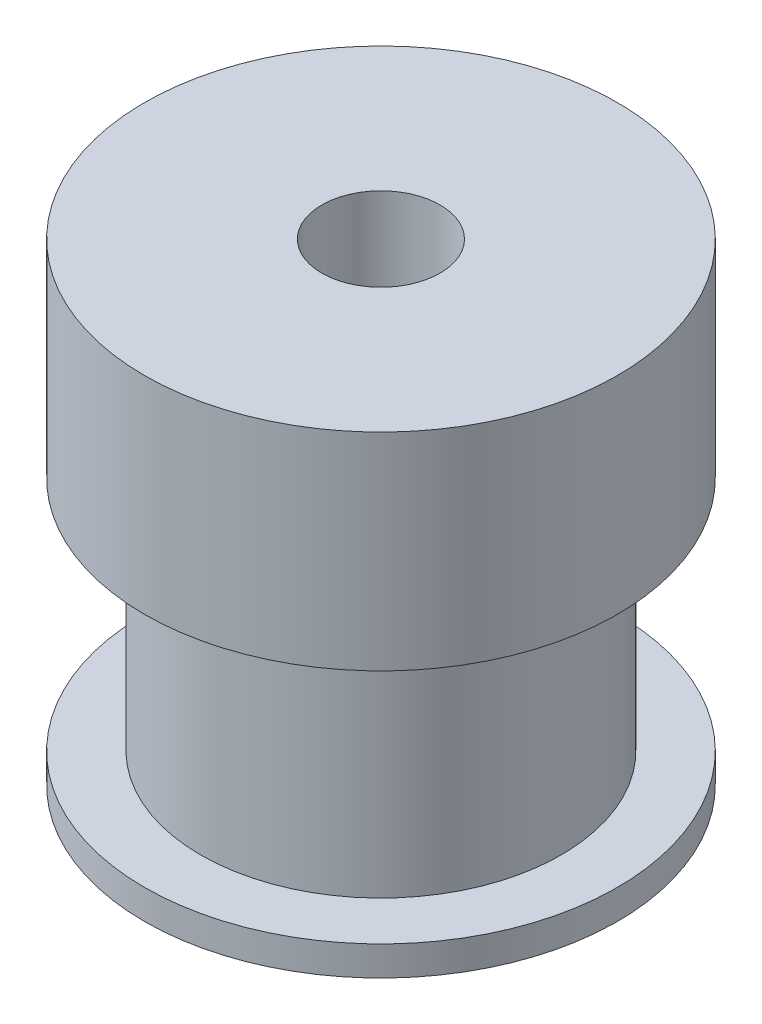
from build123d import *

# Parameters (mm, degrees)
ESQUISSE1_R      = 8
EXTRUSION1_DEPTH = 1
ESQUISSE2_R      = 6.1
EXTRUSION2_DEPTH = 8
ESQUISSE3_R      = 8
EXTRUSION3_DEPTH = 7
ESQUISSE4_R      = 2
EXTRUSION4_DEPTH = 20.595917942


with BuildPart() as part:
    # Esquisse1 → Extrusion1 (new body)
    with BuildSketch(Plane(origin=(0, 0, 0), x_dir=(1, 0, 0), z_dir=(0, 1, 0))):
        with Locations(Location((0, 0, 0), (0, 0, 270))):
            Circle(ESQUISSE1_R)
    extrude(amount=EXTRUSION1_DEPTH)

    # Esquisse2 → Extrusion2 (add)
    with BuildSketch(Plane(origin=(0, 1, 0), x_dir=(-1, 0, 0), z_dir=(0, 1, 0))):
        with Locations(Location((0, 0, 0), (0, 0, 90))):
            Circle(ESQUISSE2_R)
    extrude(amount=EXTRUSION2_DEPTH)

    # Esquisse3 → Extrusion3 (add)
    with BuildSketch(Plane(origin=(0, 9, 0), x_dir=(-1, 0, 0), z_dir=(0, 1, 0))):
        with Locations(Location((0, 0, 0), (0, 0, 90))):
            Circle(ESQUISSE3_R)
    extrude(amount=EXTRUSION3_DEPTH)

    # Esquisse4 → Extrusion4 (cut, through all)
    with BuildSketch(Plane(origin=(0, 16, 0), x_dir=(-1, 0, 0), z_dir=(0, 1, 0))):
        with Locations(Location((0, 0, 0), (0, 0, 90))):
            Circle(ESQUISSE4_R)
    extrude(amount=-EXTRUSION4_DEPTH, mode=Mode.SUBTRACT)


solid = part.part
